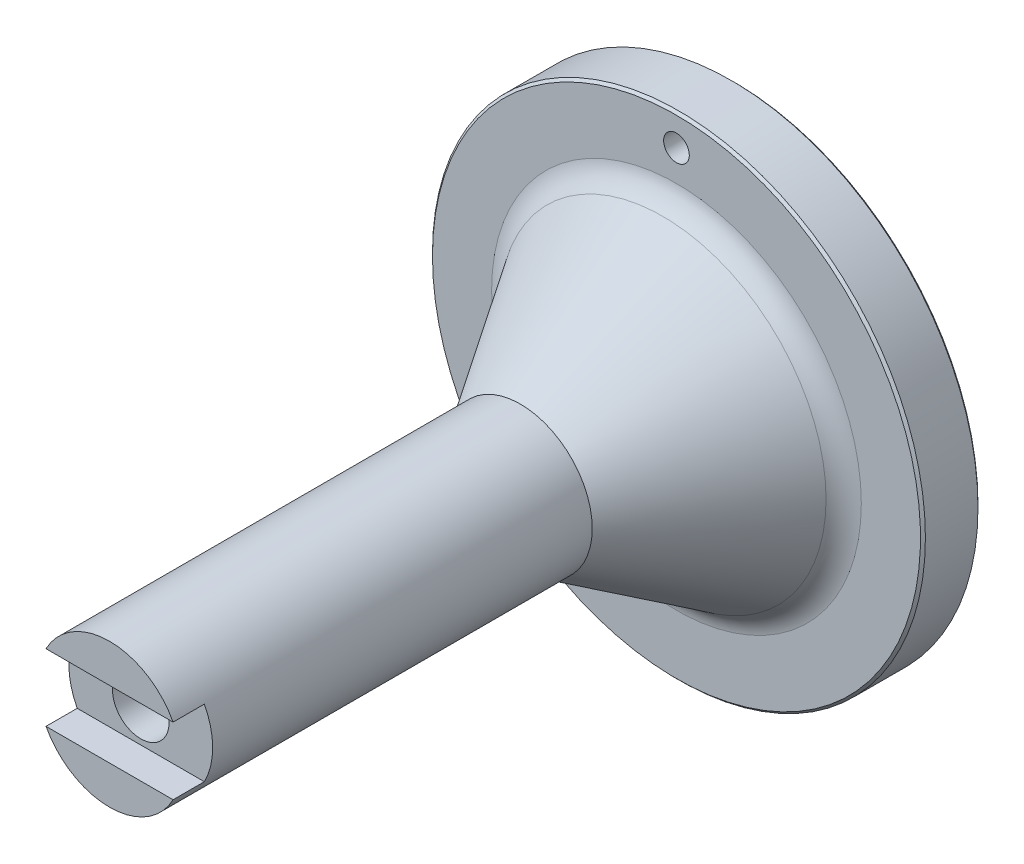
from build123d import *

# Parameters (mm, degrees)
CHAMFER1_SIZE           = 0.762
CUT_EXTRUDE1_DEPTH      = 222.082160293
CUT_EXTRUDE1_DEPTH_BACK = 222.082160293
SKETCH2_W               = 9.652
SKETCH2_H               = 20.7772
SKETCH3_R               = 3.9624
CUT_EXTRUDE2_DEPTH      = 222.082160293


with BuildPart() as part:
    # Sketch1 → Revolve1 (revolve)
    with BuildSketch(Plane(origin=(0, 0, 0), x_dir=(0, 0, -1), z_dir=(1, 0, 0)), mode=Mode.PRIVATE) as revolve1_sk:
        with BuildLine():
            Line((0, 8.7376), (0, 22.225))
            Line((0, 22.225), (127, 22.225))
            Line((127, 22.225), (170.987651441, 50.516580451))
            ThreePointArc((170.987651441, 50.516580451), (173.842981601, 53.370107614), (175.26, 57.15))
            Line((175.26, 57.15), (175.26, 76.2))
            Line((175.26, 76.2), (193.04, 76.2))
            Line((193.04, 76.2), (193.04, 57.15))
            Line((193.04, 57.15), (173.035490373, 44.283680136))
            ThreePointArc((173.035490373, 44.283680136), (168.717377059, 37.289066304), (171.452793139, 29.537406861))
            Line((171.452793139, 29.537406861), (185.1152, 15.875))
            Line((185.1152, 15.875), (185.1152, 8.7376))
            Line((185.1152, 8.7376), (0, 8.7376))
        make_face()
    revolve(revolve1_sk.sketch.rotate(Axis((0, 0, 0), (0, 0, -1)), 90), axis=Axis((0, 0, 0), (0, 0, -1)))

    # Chamfer1
    chamfer1_edges = [part.edges().sort_by_distance(p)[0] for p in [
        (-76.2, 0, -193.04),
        (-76.2, 0, -175.26),
    ]]
    chamfer(chamfer1_edges, length=CHAMFER1_SIZE)

    # Sketch2 → Cut-Extrude1 (cut, two sides: drawn at the far end of the back side and taken through both)
    with BuildSketch(Plane(origin=(0, 0, 0), x_dir=(0, 0, -1), z_dir=(1, 0, 0)).offset(-CUT_EXTRUDE1_DEPTH_BACK)):
        with Locations((4.826, 0)):
            Rectangle(SKETCH2_W, SKETCH2_H)
    extrude(amount=CUT_EXTRUDE1_DEPTH + CUT_EXTRUDE1_DEPTH_BACK, mode=Mode.SUBTRACT)

    # Sketch3 → Cut-Extrude2 (cut, through all)
    with BuildSketch(Plane(origin=(0, 0, -193.04), x_dir=(-1, 0, 0), z_dir=(0, 0, -1))):
        with Locations((0, 66.675)):
            Circle(SKETCH3_R)
    extrude(amount=-CUT_EXTRUDE2_DEPTH, mode=Mode.SUBTRACT)


solid = part.part
